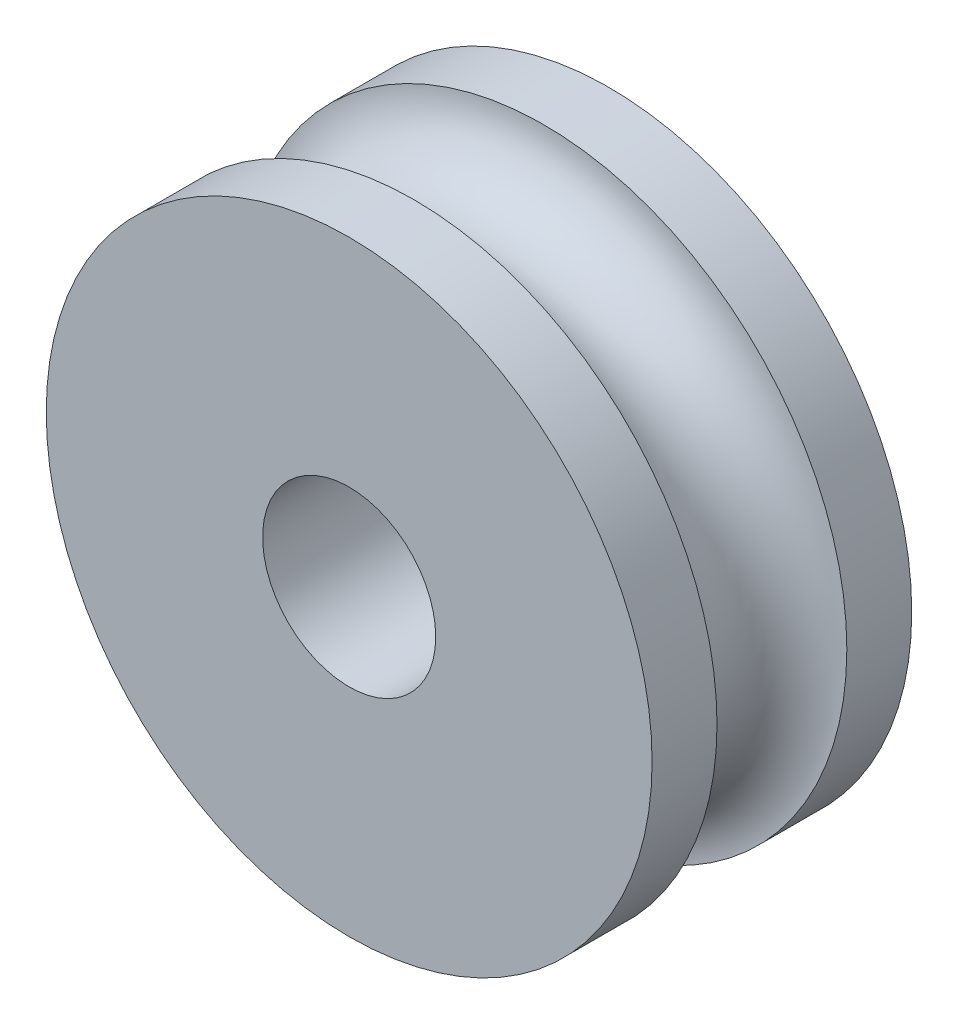
from build123d import *

# Parameters (mm, degrees)
CROQUIS1_R              = 3.5
SALIENTE_EXTRUIR1_DEPTH = 3
CROQUIS2_R              = 0.75
CROQUIS3_R              = 1
CORTAR_EXTRUIR1_DEPTH   = 6.787918451


with BuildPart() as part:
    # Croquis1 → Saliente-Extruir1 (new body)
    with BuildSketch(Plane.XY):
        Circle(CROQUIS1_R)
    extrude(amount=SALIENTE_EXTRUIR1_DEPTH)

    # Croquis2 → Cortar-Revolución1 (revolve, cut)
    with BuildSketch(Plane(origin=(0, 0, 0), x_dir=(0, 0, -1), z_dir=(1, 0, 0)), mode=Mode.PRIVATE) as cortar_revoluci_n1_sk:
        with Locations((-1.5, 3.5)):
            Circle(CROQUIS2_R)
    revolve(cortar_revoluci_n1_sk.sketch.rotate(Axis((0, 0, 3), (0, 0, -1)), 90), axis=Axis((0, 0, 3), (0, 0, -1)), mode=Mode.SUBTRACT)

    # Croquis3 → Cortar-Extruir1 (cut, through all)
    with BuildSketch(Plane.XY.offset(3)):
        Circle(CROQUIS3_R)
    extrude(amount=-CORTAR_EXTRUIR1_DEPTH, mode=Mode.SUBTRACT)


solid = part.part
